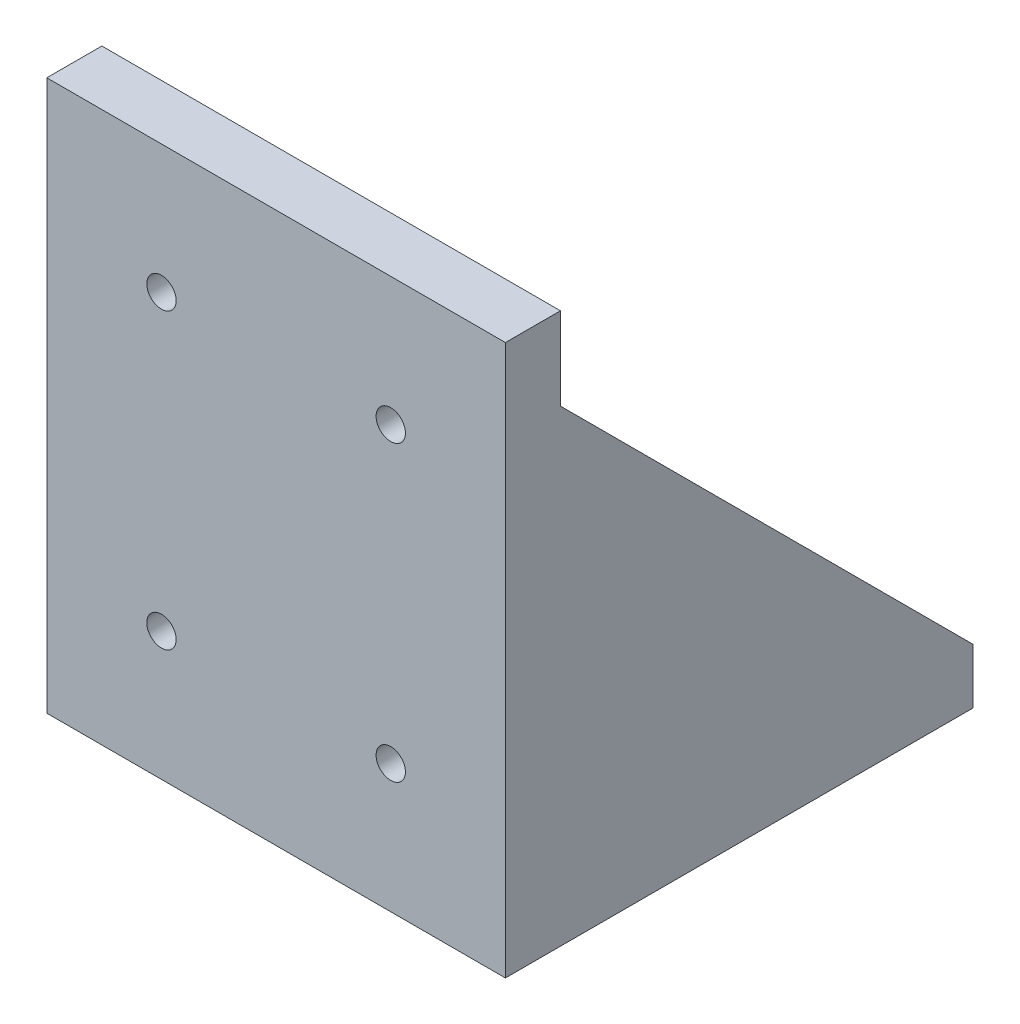
from build123d import *

# Parameters (mm, degrees)
SKETCH_1_W          = 50
SKETCH_1_H          = 45
SKETCH_1_R          = 1.65
SKETCH_1_R_2        = 13
EXTRUDE_1_DEPTH     = 6
SKETCH_3_W          = 50
SKETCH_3_H          = 60
EXTRUDE_2_DEPTH     = 6
EXTRUDE_3_DEPTH     = 3
SKETCH_5_R          = 1.6
CUT_EXTRUDE_1_DEPTH = 80.056941504
SKETCH_6_R          = 3.5
CUT_EXTRUDE_2_DEPTH = 2


with BuildPart() as part:
    # 草图1 → 凸台-拉伸1 (new body)
    with BuildSketch(Plane(origin=(0, 0, 0), x_dir=(1, 0, 0), z_dir=(0, 1, 0))):
        with Locations((0, 1.3)):
            Rectangle(SKETCH_1_W, SKETCH_1_H)
        with Locations(Location((-15.5, 15.5, 0), (0, 0, 270))):
            Circle(SKETCH_1_R, mode=Mode.SUBTRACT)
        with Locations(Location((15.5, 15.5, 0), (0, 0, 270))):
            Circle(SKETCH_1_R, mode=Mode.SUBTRACT)
        with Locations(Location((15.5, -15.5, 0), (0, 0, 270))):
            Circle(SKETCH_1_R, mode=Mode.SUBTRACT)
        with Locations(Location((-15.5, -15.5, 0), (0, 0, 270))):
            Circle(SKETCH_1_R, mode=Mode.SUBTRACT)
        with Locations(Location((0, 0, 0), (0, 0, 270))):
            Circle(SKETCH_1_R_2, mode=Mode.SUBTRACT)
    extrude(amount=EXTRUDE_1_DEPTH)

    # 草图3 → 凸台-拉伸2 (add)
    with BuildSketch(Plane.XY.offset(21.2)):
        with Locations((0, 30)):
            Rectangle(SKETCH_3_W, SKETCH_3_H)
    extrude(amount=EXTRUDE_2_DEPTH)

    # 草图4 → 凸台-拉伸3 (add)
    with BuildSketch(Plane.ZY.offset(25)):
        Polygon((-23.8, 6), (21.2, 51), (21.2, 6), align=None)
    extrude_3 = extrude(amount=-EXTRUDE_3_DEPTH)

    # 镜向1: 凸台-拉伸3 across plane
    add(extrude_3.mirror(Plane(origin=(0, 0, 0), x_dir=(0, 0, 1), z_dir=(1, 0, 0))))

    # 草图5 → 切除-拉伸1 (cut, through all)
    with BuildSketch(Plane(origin=(0, 0, 21.2), x_dir=(-1, 0, 0), z_dir=(0, 0, -1))):
        with Locations((-12.5, 46)):
            Circle(SKETCH_5_R)
        with Locations((-12.5, 14)):
            Circle(SKETCH_5_R)
        with Locations(Location((12.5, 14, 0), (0, 0, 180))):
            Circle(SKETCH_5_R)
        with Locations(Location((12.5, 46, 0), (0, 0, 180))):
            Circle(SKETCH_5_R)
    extrude(amount=-CUT_EXTRUDE_1_DEPTH, mode=Mode.SUBTRACT)

    # 草图6 → 切除-拉伸2 (cut)
    with BuildSketch(Plane(origin=(0, 0, 21.2), x_dir=(-1, 0, 0), z_dir=(0, 0, -1))):
        with Locations((-12.5, 46)):
            Circle(SKETCH_6_R)
        with Locations((12.5, 46)):
            Circle(SKETCH_6_R)
        with Locations((-12.5, 14)):
            Circle(SKETCH_6_R)
        with Locations((12.5, 14)):
            Circle(SKETCH_6_R)
    extrude(amount=-CUT_EXTRUDE_2_DEPTH, mode=Mode.SUBTRACT)


solid = part.part
